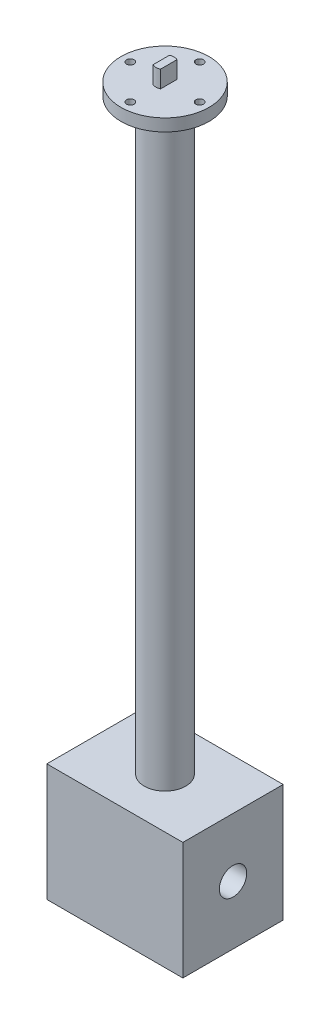
from build123d import *

# Parameters (mm, degrees)
SKETCH1_R                       = 22.86
BOSS_EXTRUDE1_DEPTH             = 6.35
BOSS_EXTRUDE2_DEPTH             = 8.89
SKETCH3_R                       = 10.795
BOSS_EXTRUDE3_DEPTH             = 304.8
CHAMFER1_SIZE                   = 3.81
F_5_32_0_15625_DIAMETER_HOLE1_D = 3.96875
CIRPATTERN1_COUNT               = 4
SKETCH7_W                       = 70.612
SKETCH7_H                       = 52.07
BOSS_EXTRUDE4_DEPTH             = 60.96
SKETCH8_R                       = 7.112
CUT_EXTRUDE1_DEPTH              = 374.42235253


with BuildPart() as part:
    # Sketch1 → Boss-Extrude1 (new body)
    with BuildSketch(Plane(origin=(0, 0, 0), x_dir=(1, 0, 0), z_dir=(0, 1, 0))):
        with Locations(Location((0, 0, 0), (0, 0, 270))):
            Circle(SKETCH1_R)
    extrude(amount=BOSS_EXTRUDE1_DEPTH)

    # Sketch2 → Boss-Extrude2 (add)
    with BuildSketch(Plane(origin=(0, 6.35, 0), x_dir=(1, 0, 0), z_dir=(0, 1, 0))):
        with BuildLine():
            Line((1.9685, -4.266803107), (1.9685, 4.266803107))
            ThreePointArc((1.9685, 4.266803107), (0, 4.699), (-1.9685, 4.266803107))
            Line((-1.9685, 4.266803107), (-1.9685, -4.266803107))
            ThreePointArc((-1.9685, -4.266803107), (0, -4.699), (1.9685, -4.266803107))
        make_face()
    extrude(amount=BOSS_EXTRUDE2_DEPTH)

    # Sketch3 → Boss-Extrude3 (add)
    with BuildSketch(Plane.XZ):
        with Locations(Location((0, 0, 0), (0, 0, 90))):
            Circle(SKETCH3_R)
    extrude(amount=BOSS_EXTRUDE3_DEPTH)

    # Chamfer1
    chamfer1_edges = [part.edges().sort_by_distance(p)[0] for p in [
        (0, 0, -10.795),
    ]]
    chamfer(chamfer1_edges, length=CHAMFER1_SIZE)

    # 5/32 (0.15625) Diameter Hole1 (through all)
    with Locations(Plane(origin=(0, 6.35, 0), x_dir=(1, 0, 0), z_dir=(0, 1, 0))):
        with Locations((0, 18)):
            f_5_32_0_15625_diameter_hole1 = Hole(F_5_32_0_15625_DIAMETER_HOLE1_D / 2)

    # CirPattern1: 5/32 (0.15625) Diameter Hole1 ×4 about axis
    cirpattern1_axis = Axis((0, 0, 0), (0, 1, 0))
    for i in range(1, CIRPATTERN1_COUNT):
        add(f_5_32_0_15625_diameter_hole1.rotate(cirpattern1_axis, i * 360 / CIRPATTERN1_COUNT), mode=Mode.SUBTRACT)

    # Sketch7 → Boss-Extrude4 (add)
    with BuildSketch(Plane.XZ.offset(304.8)):
        Rectangle(SKETCH7_W, SKETCH7_H)
    extrude(amount=BOSS_EXTRUDE4_DEPTH)

    # Sketch8 → Cut-Extrude1 (cut, through all)
    with BuildSketch(Plane(origin=(35.306, 0, 0), x_dir=(0, 0, -1), z_dir=(1, 0, 0))):
        with Locations((0, -335.28)):
            Circle(SKETCH8_R)
    extrude(amount=-CUT_EXTRUDE1_DEPTH, mode=Mode.SUBTRACT)


solid = part.part
